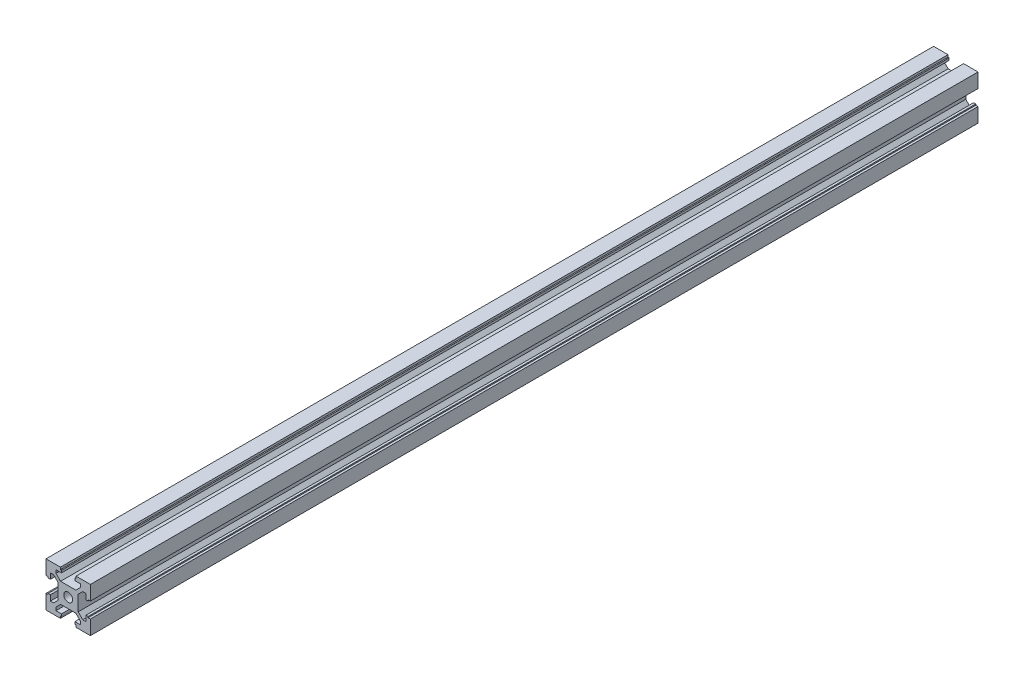
from build123d import *

# Parameters (mm, degrees)
SKETCH1_R           = 2
BOSS_EXTRUDE1_DEPTH = 400


with BuildPart() as part:
    # Sketch1 → Boss-Extrude1 (new body)
    with BuildSketch(Plane.XY):
        Polygon((-10, -10), (-3.5, -10), (-3.5, -9), (-3, -9), (-3, -8), (-5.5, -8), (-5.5, -6.560660172), (-3.44, -4.500660172), (3.44, -4.500660172), (5.5, -6.560660172), (5.5, -8), (3, -8), (3, -9), (3.5, -9), (3.5, -10), (10, -10), (10, -3.5), (9, -3.5), (9, -3), (8, -3), (8, -5.5), (6.560660172, -5.5), (4.500660172, -3.44), (4.500660172, 3.44), (6.560660172, 5.5), (8, 5.5), (8, 3), (9, 3), (9, 3.5), (10, 3.5), (10, 10), (3.5, 10), (3.5, 9), (3, 9), (3, 8), (5.5, 8), (5.5, 6.560660172), (3.44, 4.500660172), (-3.44, 4.500660172), (-5.5, 6.560660172), (-5.5, 8), (-3, 8), (-3, 9), (-3.5, 9), (-3.5, 10), (-10, 10), (-10, 3.5), (-9, 3.5), (-9, 3), (-8, 3), (-8, 5.5), (-6.560660172, 5.5), (-4.500660172, 3.44), (-4.500660172, -3.44), (-6.560660172, -5.5), (-8, -5.5), (-8, -3), (-9, -3), (-9, -3.5), (-10, -3.5), align=None)
        Circle(SKETCH1_R, mode=Mode.SUBTRACT)
    extrude(amount=BOSS_EXTRUDE1_DEPTH)


solid = part.part
